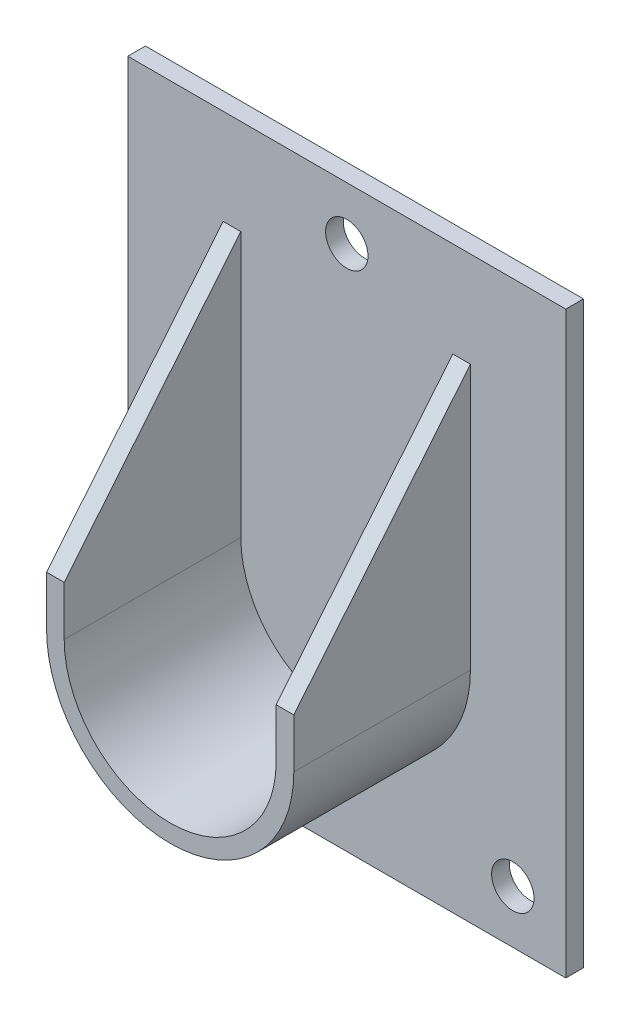
from build123d import *

# Parameters (mm, degrees)
SKETCH1_W               = 124
SKETCH1_H               = 164
SKETCH1_R               = 6
BOSS_EXTRUDE1_DEPTH     = 5
BOSS_EXTRUDE2_DEPTH     = 55
CUT_EXTRUDE1_DEPTH      = 152.122466894
CUT_EXTRUDE1_DEPTH_BACK = 152.122466894


with BuildPart() as part:
    # Sketch1 → Boss-Extrude1 (new body)
    with BuildSketch(Plane.XY):
        with Locations((0, 20)):
            Rectangle(SKETCH1_W, SKETCH1_H)
        with Locations((0, 87)):
            Circle(SKETCH1_R, mode=Mode.SUBTRACT)
        with Locations((47, -47)):
            Circle(SKETCH1_R, mode=Mode.SUBTRACT)
        with Locations((-47, -47)):
            Circle(SKETCH1_R, mode=Mode.SUBTRACT)
        with BuildLine():
            Line((35, 75), (35, 0))
            ThreePointArc((35, 0), (0, -35), (-35, 0))
            Line((-35, 0), (-35, 75))
            Line((-35, 75), (-30, 75))
            Line((-30, 75), (-30, 0))
            ThreePointArc((-30, 0), (0, -30), (30, 0))
            Line((30, 0), (30, 75))
            Line((30, 75), (35, 75))
        make_face(mode=Mode.SUBTRACT)
    extrude(amount=BOSS_EXTRUDE1_DEPTH)

    # Sketch1<2> → Boss-Extrude2 (add)
    with BuildSketch(Plane.XY):
        with BuildLine():
            Line((35, 0), (35, 75))
            Line((35, 75), (30, 75))
            Line((30, 75), (30, 0))
            ThreePointArc((30, 0), (0, -30), (-30, 0))
            Line((-30, 0), (-30, 75))
            Line((-30, 75), (-35, 75))
            Line((-35, 75), (-35, 0))
            ThreePointArc((-35, 0), (0, -35), (35, 0))
        make_face()
    extrude(amount=BOSS_EXTRUDE2_DEPTH)

    # Sketch2 → Cut-Extrude1 (cut, two sides: drawn at the far end of the back side and taken through both)
    with BuildSketch(Plane(origin=(35, 0, 0), x_dir=(0, 0, -1), z_dir=(1, 0, 0)).offset(-CUT_EXTRUDE1_DEPTH_BACK)):
        Polygon((-55, 14), (-5, 75), (-55, 75), align=None)
    extrude(amount=CUT_EXTRUDE1_DEPTH + CUT_EXTRUDE1_DEPTH_BACK, mode=Mode.SUBTRACT)


solid = part.part
